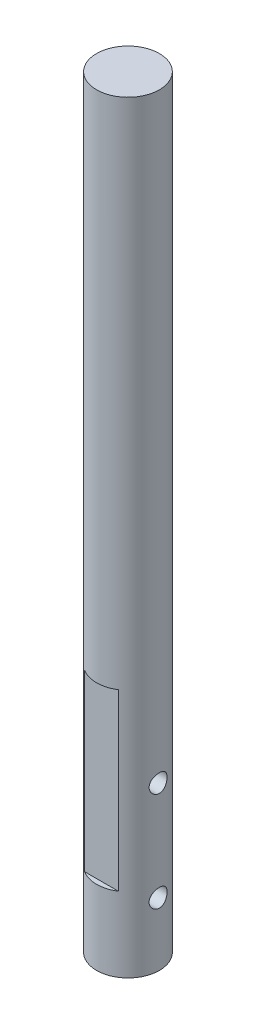
from build123d import *

# Parameters (mm, degrees)
EXTRUDE_START       = -10
SKETCH_1_R          = 3.5
EXTRUDE_1_DEPTH     = 85
SKETCH_2_W          = 4.358557255
SKETCH_2_H          = 19.447665258
SKETCH_2_W_2        = 4.358557256
CUT_EXTRUDE_2_DEPTH = 9
SKETCH_3_R          = 1
CUT_EXTRUDE_3_DEPTH = 9


with BuildPart() as part:
    # Эскиз1 → Вытянуть1 (new body)
    with BuildSketch(Plane(origin=(0, 0, 0), x_dir=(1, 0, 0), z_dir=(0, 1, 0)).offset(EXTRUDE_START)):
        with Locations(Location((1.708090692, -2.563541488, 0), (0, 0, 270))):
            Circle(SKETCH_1_R)
    extrude(amount=EXTRUDE_1_DEPTH)

    # Эскиз2 → Вытянуть2 (cut, symmetric)
    with BuildSketch(Plane(origin=(0, 0, 0), x_dir=(0, 0, -1), z_dir=(1, 0, 0))):
        with Locations((-7.693664616, 8.043574294)):
            Rectangle(SKETCH_2_W, SKETCH_2_H)
        with Locations((2.56658164, 8.043574294)):
            Rectangle(SKETCH_2_W_2, SKETCH_2_H)
    extrude(amount=CUT_EXTRUDE_2_DEPTH, both=True, mode=Mode.SUBTRACT)

    # Эскиз3 → Вытянуть3 (cut, symmetric)
    with BuildSketch(Plane(origin=(0, 0, 0), x_dir=(0, 0, -1), z_dir=(1, 0, 0))):
        with Locations((-2.563541488, -2.980105713)):
            Circle(SKETCH_3_R)
        with Locations((-2.563541488, 8.092188022)):
            Circle(SKETCH_3_R)
    extrude(amount=CUT_EXTRUDE_3_DEPTH, both=True, mode=Mode.SUBTRACT)


solid = part.part
